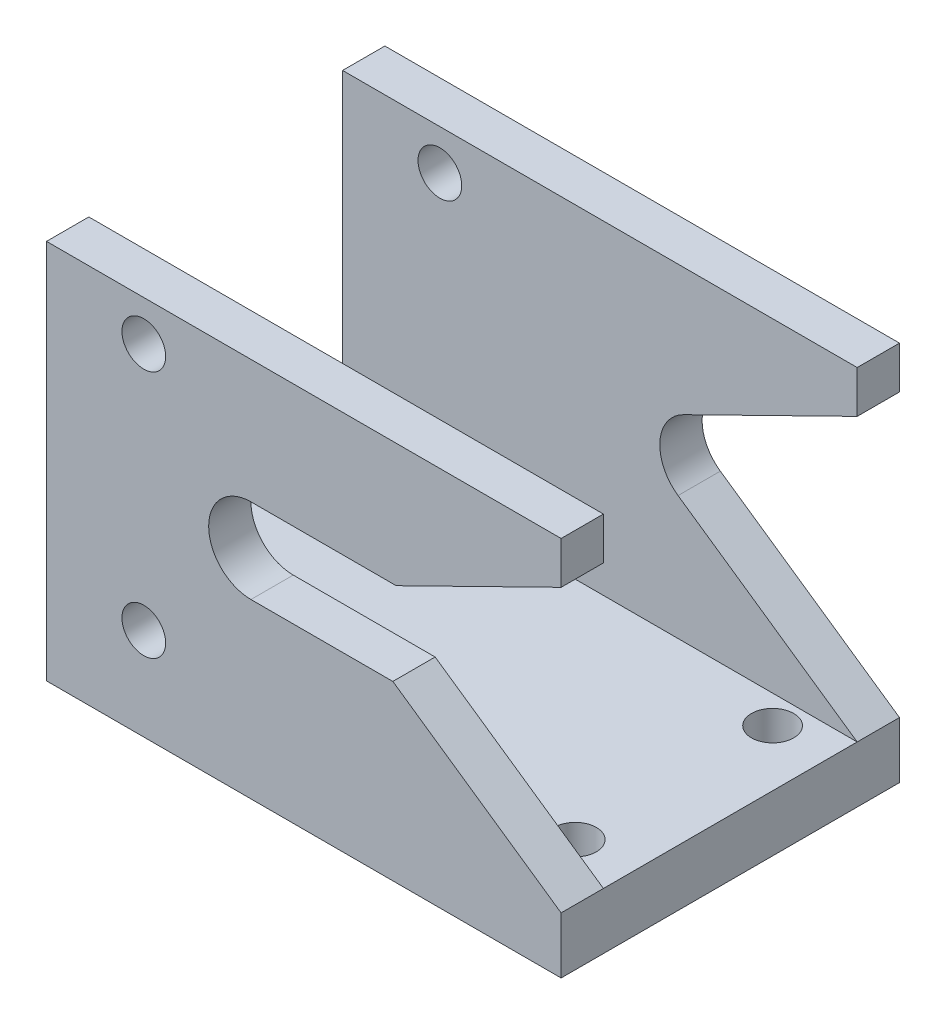
from build123d import *

# Parameters (mm, degrees)
SKETCH1_W           = 36.5
SKETCH1_H           = 24
BOSS_EXTRUDE1_DEPTH = 4
SKETCH2_W           = 36.5
SKETCH2_H           = 3
BOSS_EXTRUDE2_DEPTH = 23
SKETCH3_R           = 3
SKETCH3_R_2         = 1.55
CUT_EXTRUDE2_DEPTH  = 52.354162441
CUT_EXTRUDE3_REACH  = 53.354
SKETCH6_R           = 1.5
CUT_EXTRUDE4_DEPTH  = 50.368512232


with BuildPart() as part:
    # Sketch1 → Boss-Extrude1 (new body)
    with BuildSketch(Plane(origin=(0, 0, 0), x_dir=(1, 0, 0), z_dir=(0, 1, 0))):
        with Locations((18.25, 12)):
            Rectangle(SKETCH1_W, SKETCH1_H)
    extrude(amount=BOSS_EXTRUDE1_DEPTH)

    # Sketch2 → Boss-Extrude2 (add)
    with BuildSketch(Plane(origin=(0, 4, 0), x_dir=(1, 0, 0), z_dir=(0, 1, 0))):
        with Locations((18.25, 1.5)):
            Rectangle(SKETCH2_W, SKETCH2_H)
        with Locations((18.25, 22.5)):
            Rectangle(SKETCH2_W, SKETCH2_H)
    extrude(amount=BOSS_EXTRUDE2_DEPTH)

    # Sketch3 → Cut-Extrude2 (cut, through all)
    with BuildSketch(Plane.XY):
        with Locations((25.5, 15.25)):
            Circle(SKETCH3_R)
        with BuildLine():
            Line((36.5, 4), (36.5, 23.997165255))
            Line((36.5, 23.997165255), (24.17707002, 17.942555713))
            ThreePointArc((24.17707002, 17.942555713), (27.086065897, 17.79644752), (28.5, 15.25))
            ThreePointArc((28.5, 15.25), (26.893321833, 12.593187197), (23.794230487, 12.782136477))
            Line((23.794230487, 12.782136477), (36.5, 4))
        make_face()
        with Locations((6.9, 24.15)):
            Circle(SKETCH3_R_2)
        with Locations((6.9, 6.55)):
            Circle(SKETCH3_R_2)
    extrude(amount=-CUT_EXTRUDE2_DEPTH, mode=Mode.SUBTRACT)

    # Sketch5 → Cut-Extrude3 (cut, up to next)
    with BuildSketch(Plane.XY, mode=Mode.PRIVATE) as cut_extrude3_sk1:
        with BuildLine():
            Line((24.17707002, 17.942555713), (24.802810523, 18.25))
            Line((24.802810523, 18.25), (14.5, 18.25))
            ThreePointArc((14.5, 18.25), (11.5, 15.25), (14.5, 12.25))
            Line((14.5, 12.25), (24.564111876, 12.25))
            Line((24.564111876, 12.25), (23.794230487, 12.782136477))
            ThreePointArc((23.794230487, 12.782136477), (22.508221795, 15.471953085), (24.17707002, 17.942555713))
        make_face()
    cut_extrude3_tool1 = extrude(cut_extrude3_sk1.sketch, amount=-CUT_EXTRUDE3_REACH, mode=Mode.PRIVATE) & part.part
    add(cut_extrude3_tool1.solids().sort_by_distance((17.630744, 15.252153, 0))[0], mode=Mode.SUBTRACT)

    # Sketch6 → Cut-Extrude4 (cut, through all)
    with BuildSketch(Plane(origin=(0, 4, 0), x_dir=(1, 0, 0), z_dir=(0, 1, 0))):
        with Locations(Location((4, 19, 0), (0, 0, 270))):
            Circle(SKETCH6_R)
        with Locations(Location((32.5, 19, 0), (0, 0, 90))):
            Circle(SKETCH6_R)
        with Locations(Location((32.5, 5, 0), (0, 0, 270))):
            Circle(SKETCH6_R)
        with Locations(Location((4, 5, 0), (0, 0, 90))):
            Circle(SKETCH6_R)
    extrude(amount=-CUT_EXTRUDE4_DEPTH, mode=Mode.SUBTRACT)


solid = part.part
